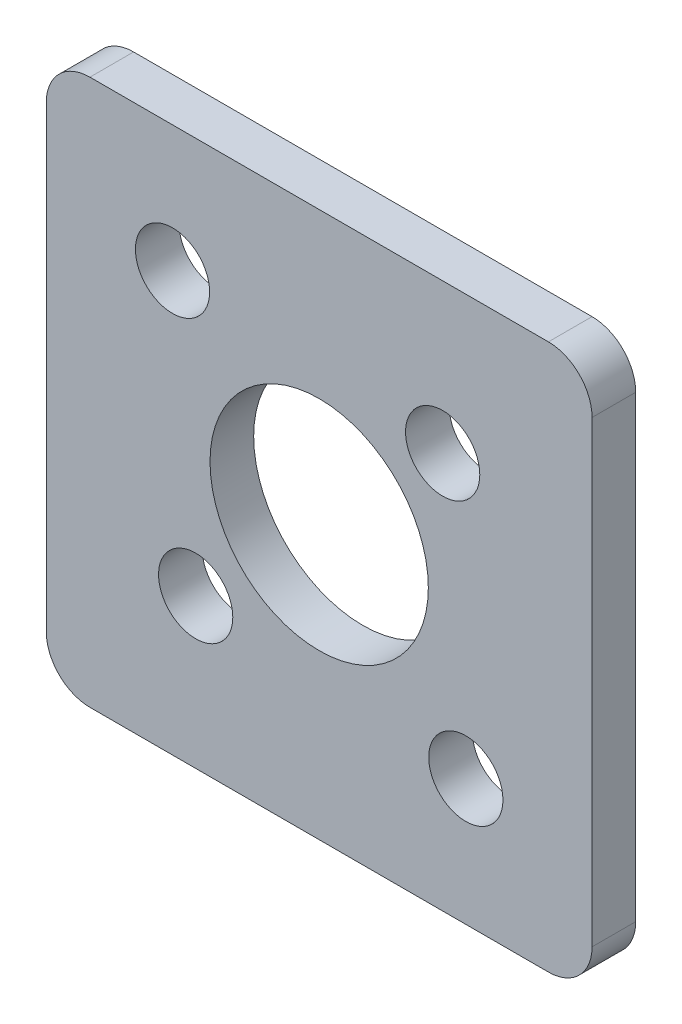
from build123d import *

# Parameters (mm, degrees)
SKETCH1_W            = 25
SKETCH1_H            = 25
SKETCH1_R            = 5
BOSS_EXTRUDE2_DEPTH  = 2
FILLET2_R            = 2
M3_CLEARANCE_HOLE1_D = 3.4


with BuildPart() as part:
    # Sketch1 → Boss-Extrude2 (new body)
    with BuildSketch(Plane.XY):
        Rectangle(SKETCH1_W, SKETCH1_H)
        Circle(SKETCH1_R, mode=Mode.SUBTRACT)
    extrude(amount=BOSS_EXTRUDE2_DEPTH)

    # Fillet2
    fillet2_edges = [part.edges().sort_by_distance(p)[0] for p in [
        (-12.5, 12.5, 1),
        (12.5, 12.5, 1),
        (12.5, -12.5, 1),
        (-12.5, -12.5, 1),
    ]]
    fillet(fillet2_edges, radius=FILLET2_R)

    # M3 Clearance Hole1 (through all)
    with Locations(Plane.XY.offset(2)):
        with Locations((-6.717514421, 6.717514421), (5.656854249, 5.656854249), (6.717514421, -6.717514421), (-5.656854249, -5.656854249)):
            Hole(M3_CLEARANCE_HOLE1_D / 2)


solid = part.part
